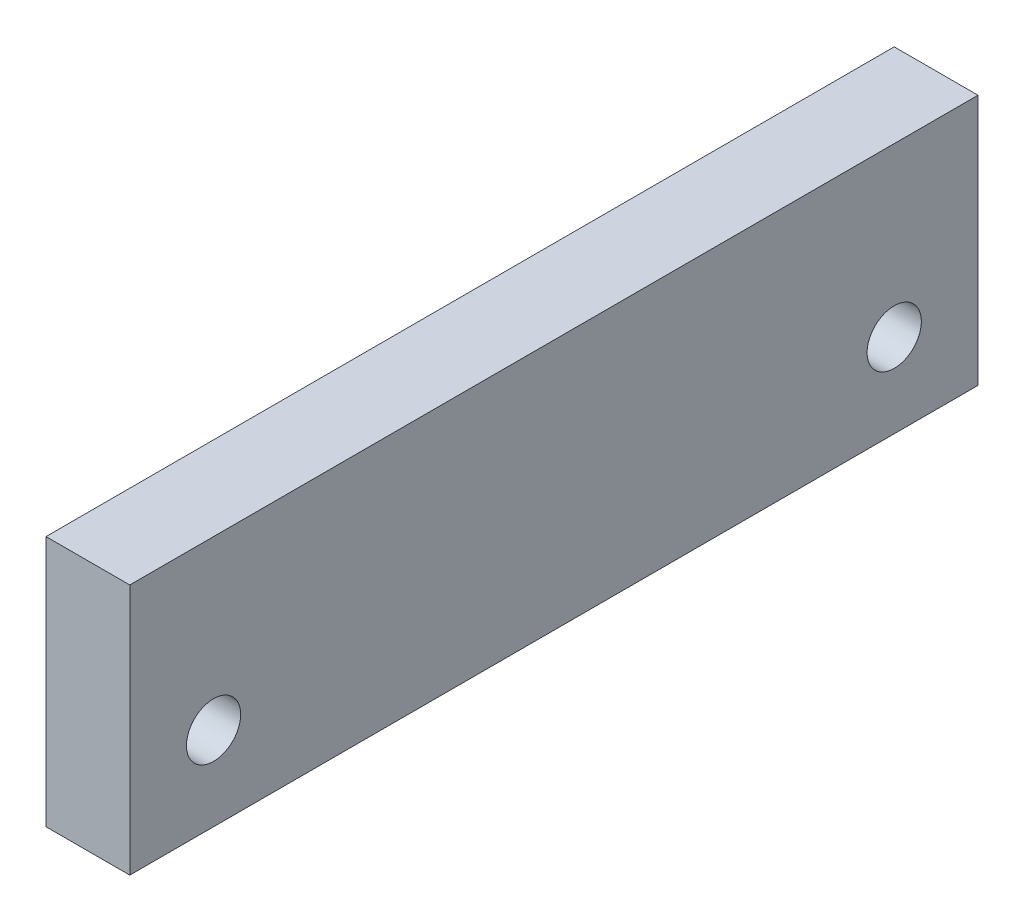
from build123d import *

# Parameters (mm, degrees)
SKETCH1_W      = 257.175
SKETCH1_H      = 76.2
SKETCH1_R      = 8.227896341
EXTRUDE1_DEPTH = 12.7


with BuildPart() as part:
    # Sketch1 → Extrude1 (new, symmetric)
    with BuildSketch(Plane(origin=(0, 0, 0), x_dir=(0, 0, -1), z_dir=(1, 0, 0))):
        with Locations((0, 12.7)):
            Rectangle(SKETCH1_W, SKETCH1_H)
        with Locations((-103.1875, 0)):
            Circle(SKETCH1_R, mode=Mode.SUBTRACT)
        with Locations((103.1875, 0)):
            Circle(SKETCH1_R, mode=Mode.SUBTRACT)
    extrude(amount=EXTRUDE1_DEPTH, both=True)


solid = part.part
